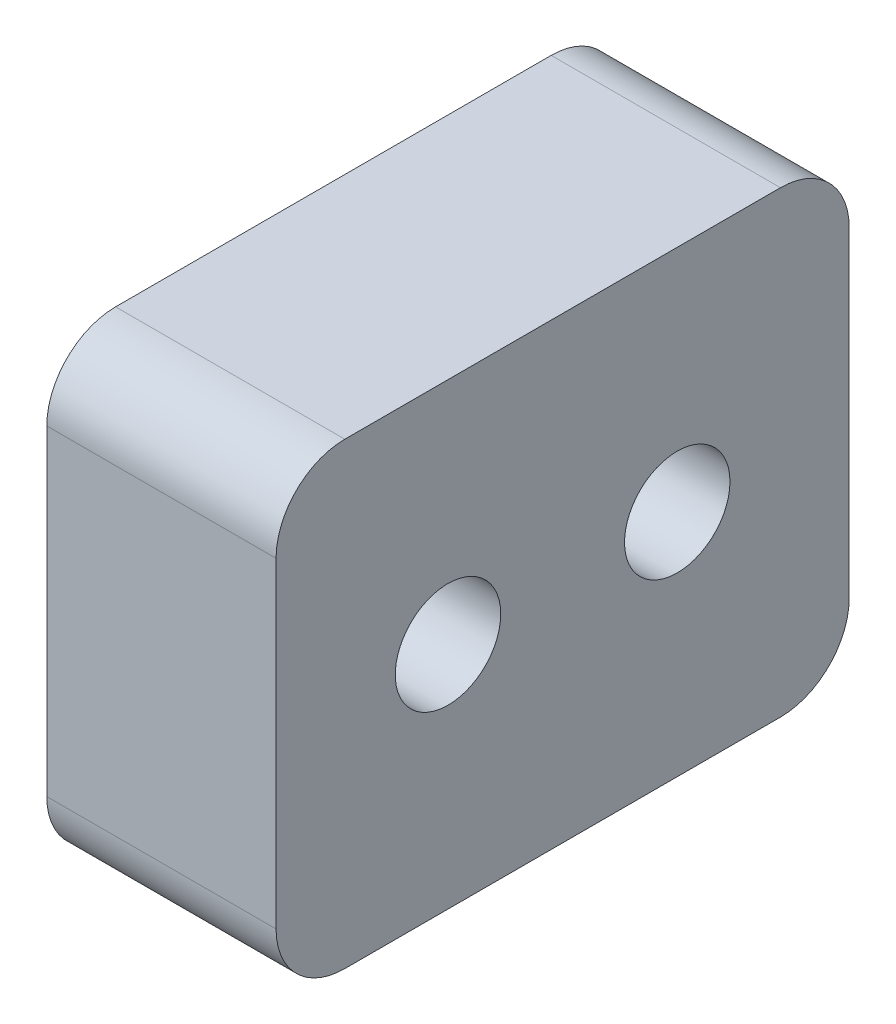
from build123d import *

# Parameters (mm, degrees)
SKETCH_1_W      = 25
SKETCH_1_H      = 20
SKETCH_1_R      = 2.3
EXTRUDE_1_DEPTH = 10
FILLET_1_R      = 3


with BuildPart() as part:
    # 草图1 → 凸台-拉伸1 (new body)
    with BuildSketch(Plane(origin=(0, 0, 0), x_dir=(0, 0, -1), z_dir=(1, 0, 0))):
        with Locations((12.5, 10)):
            Rectangle(SKETCH_1_W, SKETCH_1_H)
        with Locations((7.5, 10)):
            Circle(SKETCH_1_R, mode=Mode.SUBTRACT)
        with Locations((17.5, 10)):
            Circle(SKETCH_1_R, mode=Mode.SUBTRACT)
    extrude(amount=EXTRUDE_1_DEPTH)

    # 圆角1
    fillet_1_edges = [part.edges().sort_by_distance(p)[0] for p in [
        (5, 20, 0),
        (5, 20, -25),
        (5, 0, -25),
        (5, 0, 0),
    ]]
    fillet(fillet_1_edges, radius=FILLET_1_R)


solid = part.part
